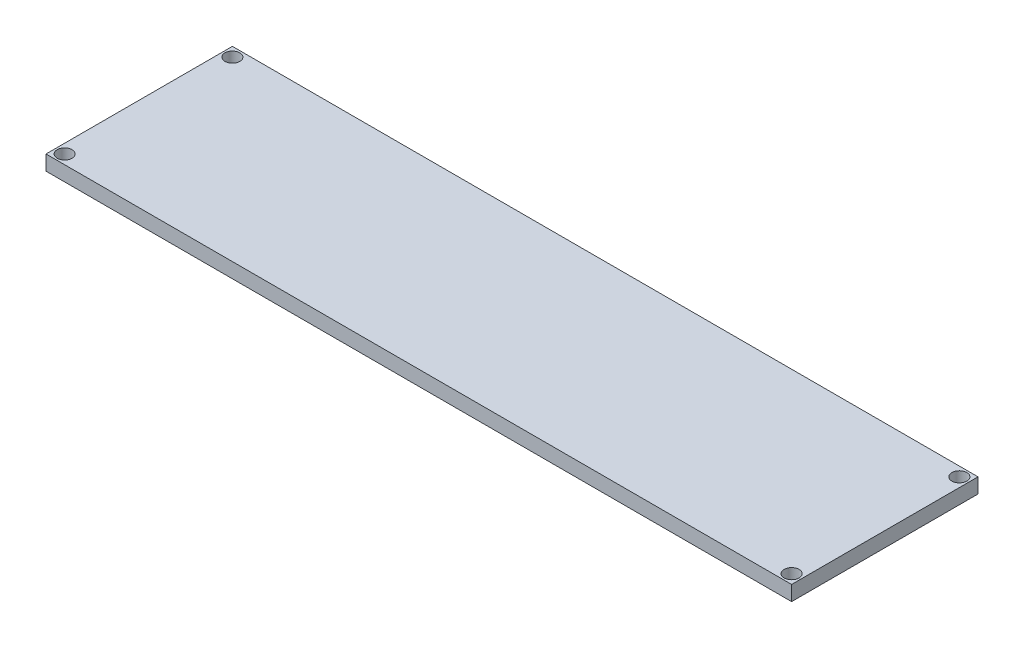
from build123d import *

# Parameters (mm, degrees)
SZKIC1_W                    = 80
SZKIC1_H                    = 20
SZKIC1_R                    = 0.8
DODANIE_WYCI_GNI_CIE1_DEPTH = 1.6


with BuildPart() as part:
    # Szkic1 → Dodanie-wyciągnięcie1 (new body)
    with BuildSketch(Plane(origin=(0, 0, 0), x_dir=(1, 0, 0), z_dir=(0, 1, 0))):
        with Locations((40, 10)):
            Rectangle(SZKIC1_W, SZKIC1_H)
        with Locations(Location((1, 19, 0), (0, 0, 270))):
            Circle(SZKIC1_R, mode=Mode.SUBTRACT)
        with Locations(Location((1, 1, 0), (0, 0, 270))):
            Circle(SZKIC1_R, mode=Mode.SUBTRACT)
        with Locations(Location((79, 1, 0), (0, 0, 270))):
            Circle(SZKIC1_R, mode=Mode.SUBTRACT)
        with Locations(Location((79, 19, 0), (0, 0, 270))):
            Circle(SZKIC1_R, mode=Mode.SUBTRACT)
    extrude(amount=DODANIE_WYCI_GNI_CIE1_DEPTH)


solid = part.part
